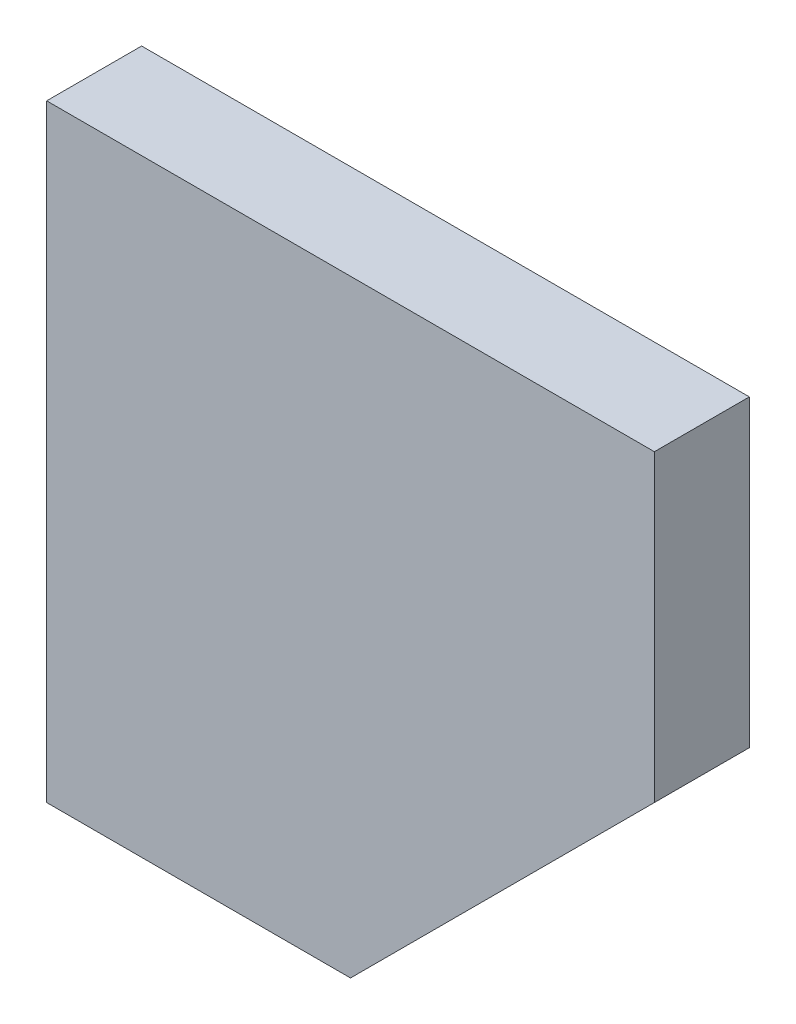
from build123d import *

# Parameters (mm, degrees)
BOSS_EXTRUDE1_DEPTH = 7.9375


with BuildPart() as part:
    # Sketch1 → Boss-Extrude1 (new body)
    with BuildSketch(Plane.XY):
        Polygon((0, 0), (0, 50.8), (50.8, 50.8), (50.8, 25.4), (25.4, 0), align=None)
    extrude(amount=BOSS_EXTRUDE1_DEPTH)


solid = part.part
